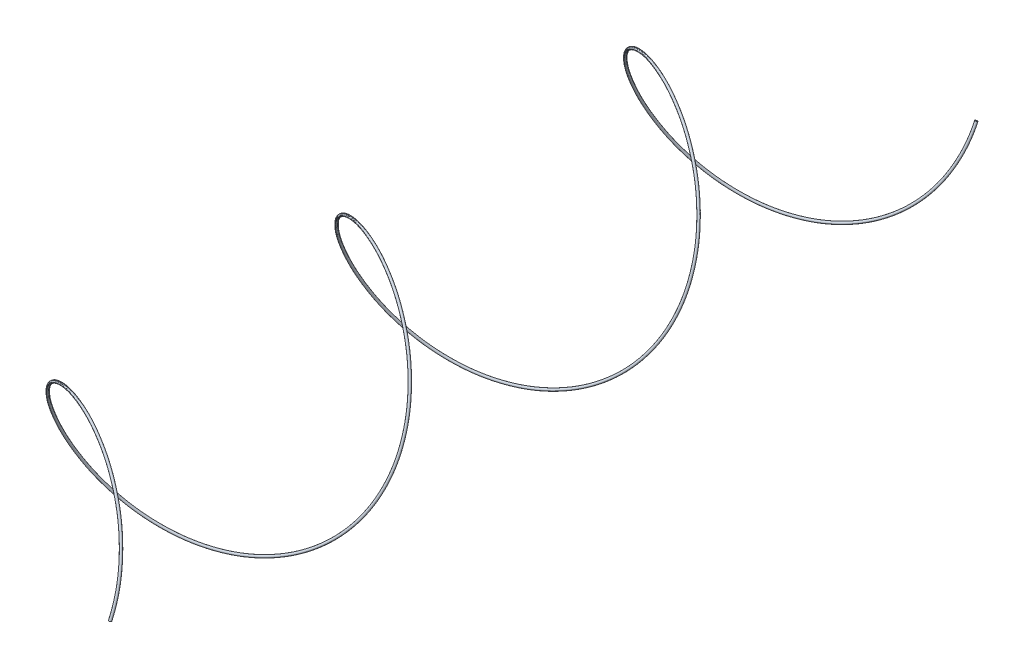
from build123d import *

# Parameters (mm, degrees)
SWEEP1_PITCH  = 11.666666667
SWEEP1_HEIGHT = 35
SWEEP1_RADIUS = 4
SKETCH4_R     = 0.05


with BuildPart() as part:
    # Sweep1: sweep along a helix
    with BuildLine() as sweep1_path:
        Helix(SWEEP1_PITCH, SWEEP1_HEIGHT, SWEEP1_RADIUS, center=(0, 0, 0), direction=(0, 0, 1), lefthand=True)
    # Sketch4 → Sweep1 (sweep)
    with BuildSketch(Plane(origin=(4, 0, 0), x_dir=(-1, 0, 0), z_dir=(0, -0.9070379965996777, 0.42104877713210737))):
        with Locations((0.047003984, 0)):
            Circle(SKETCH4_R)
    sweep(path=sweep1_path.line, is_frenet=True)


solid = part.part
